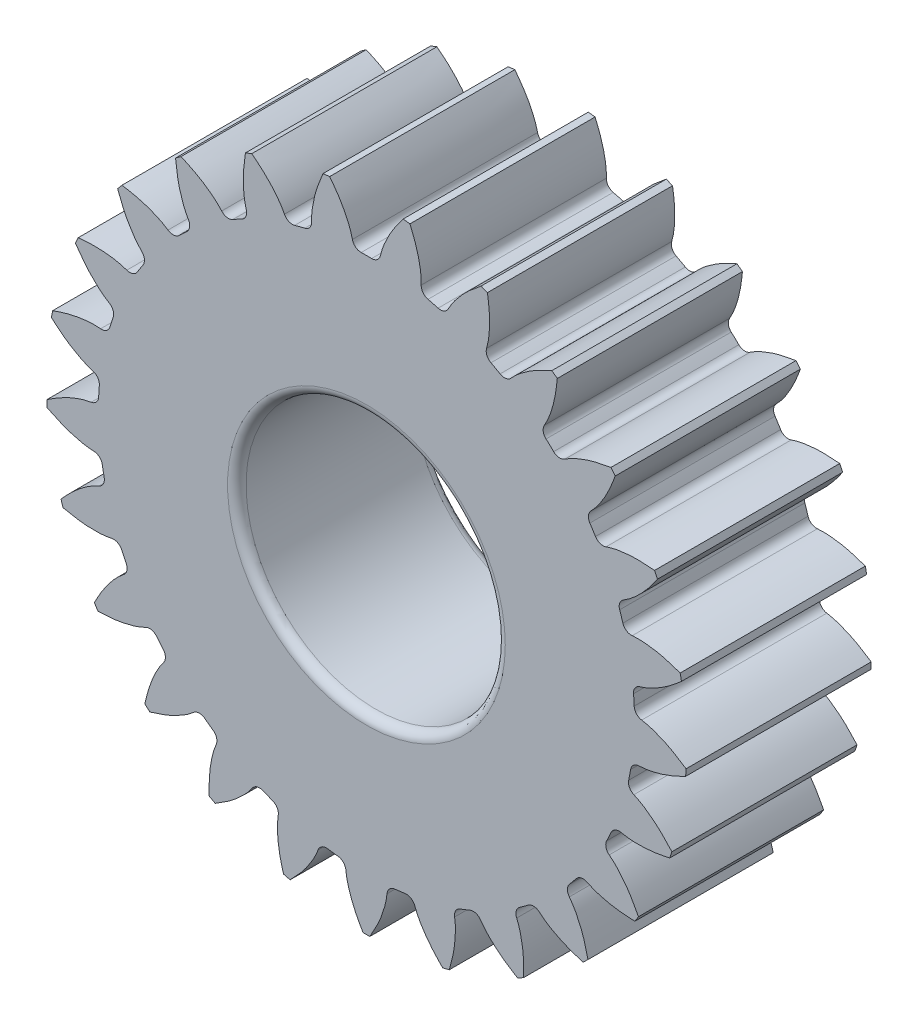
from build123d import *

# Parameters (mm, degrees)
SKETCH_1_R               = 34.575
EXTRUDE_1_DEPTH          = 20
CUT_EXTRUDE_1_DEPTH      = 20
PATTERN_CIRCULAR_1_COUNT = 25
SKETCH_3_R               = 14
CUT_EXTRUDE_2_DEPTH      = 53.797788435
FILLET_1_R               = 1


with BuildPart() as part:
    # 草图1 → 凸台-拉伸1 (new body)
    with BuildSketch(Plane.XY):
        Circle(SKETCH_1_R)
    extrude(amount=EXTRUDE_1_DEPTH)

    # 草图2 → 切除-拉伸1 (cut)
    with BuildSketch(Plane(origin=(0, 0, 0), x_dir=(-1, 0, 0), z_dir=(0, 0, -1))):
        with BuildLine():
            ThreePointArc((0.564655758, 28.944492807), (0, 28.95), (-0.564655758, 28.944492807))
            ThreePointArc((-0.564655758, 28.944492807), (-1.173621412, 29.150077648), (-1.512324687, 29.696323367))
            add(Edge.make_bspline(
                [(-1.512324687, 29.696323367), (-1.530305218, 29.780704055), (-1.615054452, 30.11898587), (-1.836950966, 30.801303299), (-2.288842506, 31.808636103), (-2.990100906, 33.044314347), (-3.621372853, 33.884424779), (-3.968572329, 34.34648539)],
                knots=[0.129473105, 0.129473105, 0.129473105, 0.129473105, 0.171980445, 0.301358944, 0.482488313, 0.71536865, 1, 1, 1, 1], degree=3))
            ThreePointArc((-3.968572329, 34.34648539), (0, 34.575), (3.968572329, 34.34648539))
            add(Edge.make_bspline(
                [(1.512324687, 29.696323367), (1.530305218, 29.780704055), (1.615054452, 30.11898587), (1.836950966, 30.801303299), (2.288842506, 31.808636103), (2.990100906, 33.044314347), (3.621372853, 33.884424779), (3.968572329, 34.34648539)],
                knots=[0.129473105, 0.129473105, 0.129473105, 0.129473105, 0.171980445, 0.301358944, 0.482488313, 0.71536865, 1, 1, 1, 1], degree=3))
            ThreePointArc((1.512324687, 29.696323367), (1.173621412, 29.150077648), (0.564655758, 28.944492807))
        make_face()
    cut_extrude_1 = extrude(amount=-CUT_EXTRUDE_1_DEPTH, mode=Mode.SUBTRACT)

    # 阵列(圆周)1: 切除-拉伸1 ×25 about axis
    pattern_circular_1_axis = Axis((0, 0, -88.99), (0, 0, 1))
    for i in range(1, PATTERN_CIRCULAR_1_COUNT):
        add(cut_extrude_1.rotate(pattern_circular_1_axis, i * 360 / PATTERN_CIRCULAR_1_COUNT), mode=Mode.SUBTRACT)

    # 草图3 → 切除-拉伸2 (cut, through all)
    with BuildSketch(Plane.XY.offset(20)):
        Circle(SKETCH_3_R)
    extrude(amount=-CUT_EXTRUDE_2_DEPTH, mode=Mode.SUBTRACT)

    # 圆角1
    fillet_1_edges = [part.edges().sort_by_distance(p)[0] for p in [
        (-14, 0, 0),
        (-14, 0, 20),
    ]]
    fillet(fillet_1_edges, radius=FILLET_1_R)


solid = part.part
